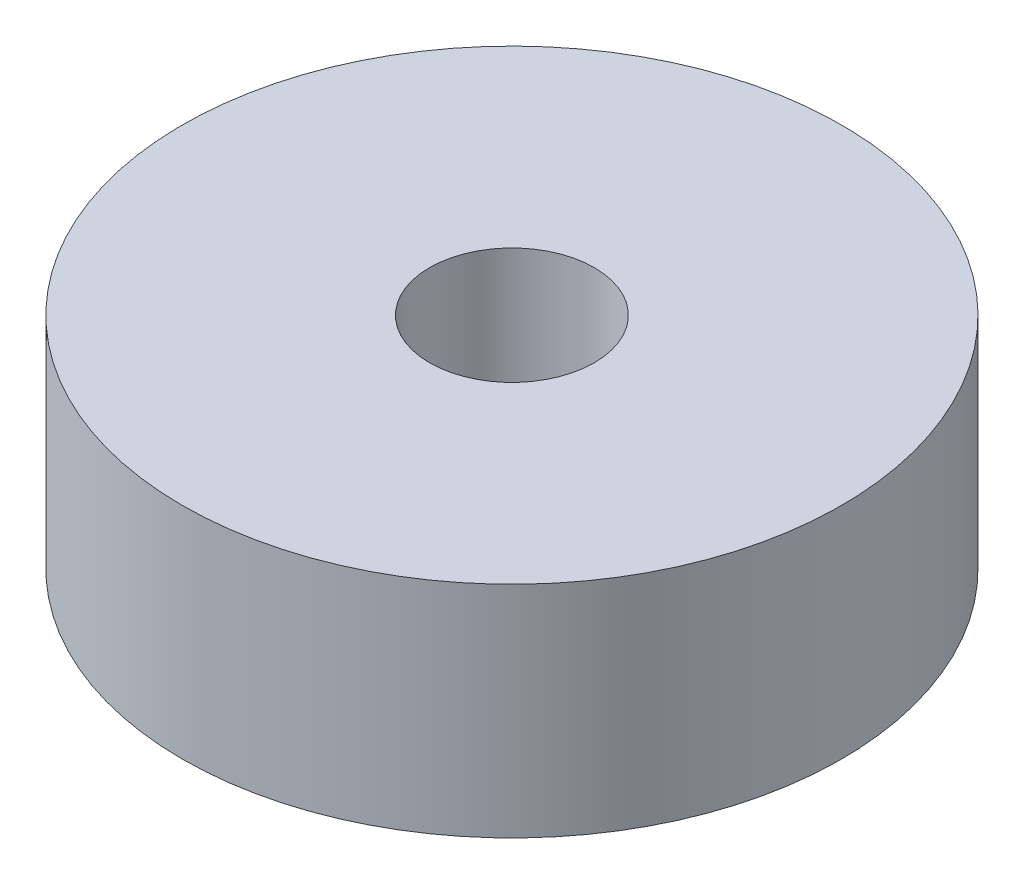
from build123d import *

# Parameters (mm, degrees)
SKETCH1_R           = 15
BOSS_EXTRUDE1_DEPTH = 10
SKETCH2_R           = 3.75
CUT_EXTRUDE1_DEPTH  = 5
SKETCH3_R           = 3.75
CUT_EXTRUDE2_DEPTH  = 24.452078799


with BuildPart() as part:
    # Sketch1 → Boss-Extrude1 (new body)
    with BuildSketch(Plane(origin=(0, 0, 0), x_dir=(1, 0, 0), z_dir=(0, 1, 0))):
        with Locations(Location((0, 0, 0), (0, 0, 270))):
            Circle(SKETCH1_R)
    extrude(amount=BOSS_EXTRUDE1_DEPTH)

    # Sketch2 → Cut-Extrude1 (cut)
    with BuildSketch(Plane.XZ):
        with Locations(Location((0, 0, 0), (0, 0, 270))):
            Circle(SKETCH2_R)
    extrude(amount=-CUT_EXTRUDE1_DEPTH, mode=Mode.SUBTRACT)

    # Sketch3 → Cut-Extrude2 (cut, through all)
    with BuildSketch(Plane(origin=(0, 10, 0), x_dir=(1, 0, 0), z_dir=(0, 1, 0))):
        with Locations(Location((0, 0, 0), (0, 0, 90))):
            Circle(SKETCH3_R)
    extrude(amount=-CUT_EXTRUDE2_DEPTH, mode=Mode.SUBTRACT)


solid = part.part
